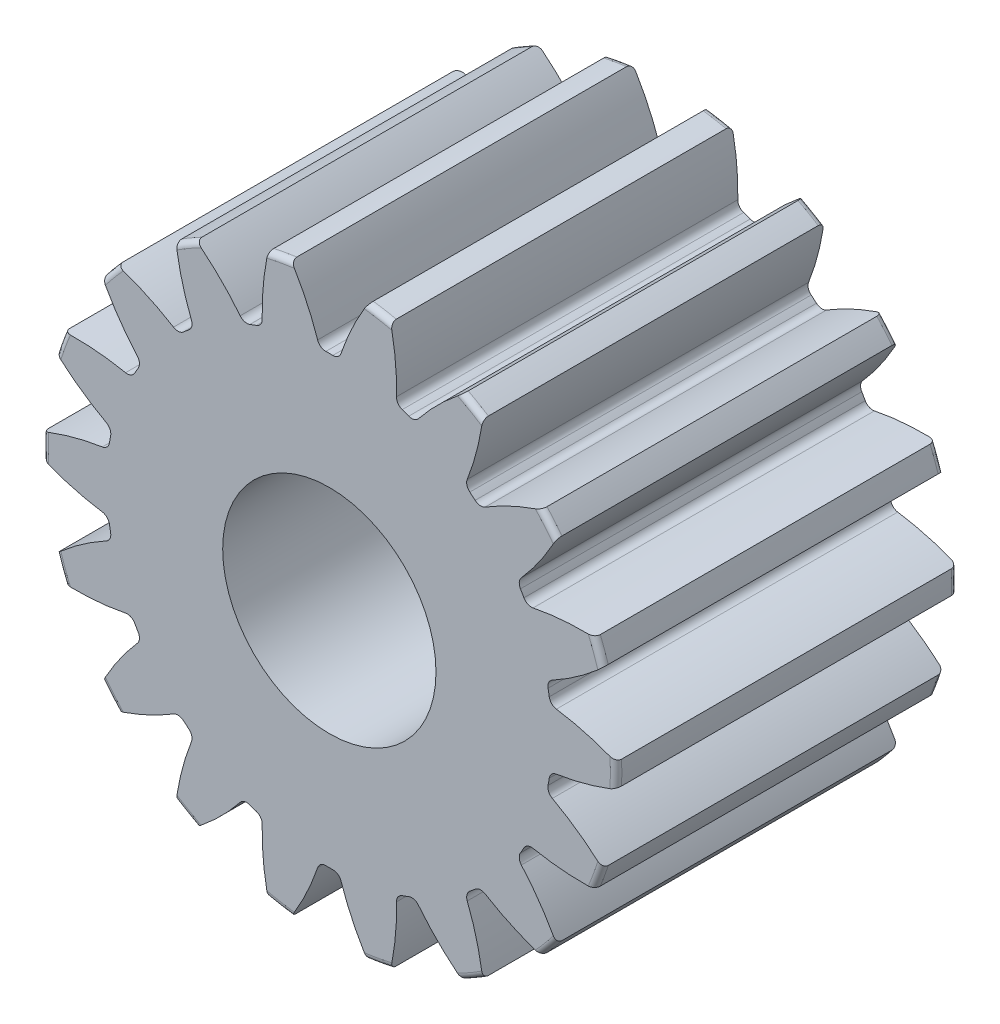
from build123d import *

# Parameters (mm, degrees)
FILLET2_R               = 0.10668
CUT_EXTRUDE2_DEPTH      = 10.860304972
CIRPATTERN1_COUNT       = 18
CUT_EXTRUDE3_DEPTH      = 13.129377689
CUT_EXTRUDE3_DEPTH_BACK = 13.129377689
SKETCH8_W               = 8.16356
SKETCH8_H               = 3.175


with BuildPart() as part:
    # Sketch4 → Revolve1 (revolve)
    with BuildSketch(Plane(origin=(0, 0, 0), x_dir=(0, 0, -1), z_dir=(1, 0, 0))):
        Polygon((-9.525, 1.984375), (-9.525, 3.9751), (-6.35, 3.9751), (-6.35, 5.334), (0, 5.334), (0, 1.984375), align=None)
    revolve(axis=Axis((0, 0, 3.175), (0, 0, 1)))

    # Fillet2
    fillet2_edges = [part.edges().sort_by_distance(p)[0] for p in [
        (0, -5.334, 0),
        (0, -5.334, 6.35),
        (0, -3.9751, 6.35),
        (0, -3.9751, 9.525),
    ]]
    fillet(fillet2_edges, radius=FILLET2_R)

    # Sketch7 → Cut-Extrude2 (cut, through all)
    with BuildSketch(Plane.XY.offset(6.35)):
        with BuildLine():
            ThreePointArc((-0.064763188, 4.142868827), (0, 4.143375), (0.064763188, 4.142868827))
            ThreePointArc((0.064763188, 4.142868827), (0.158874403, 4.171960564), (0.217710969, 4.250963782))
            ThreePointArc((0.217710969, 4.250963782), (0.433564361, 4.783553385), (0.711994388, 5.286267113))
            ThreePointArc((0.711994388, 5.286267113), (0, 5.334), (-0.711994388, 5.286267113))
            ThreePointArc((-0.711994388, 5.286267113), (-0.433564361, 4.783553385), (-0.217710969, 4.250963782))
            ThreePointArc((-0.217710969, 4.250963782), (-0.158874403, 4.171960564), (-0.064763188, 4.142868827))
        make_face()
    cut_extrude2 = extrude(amount=-CUT_EXTRUDE2_DEPTH, mode=Mode.SUBTRACT)

    # CirPattern1: Cut-Extrude2 ×18 about axis
    cirpattern1_axis = Axis((0, 0, 0), (0, 0, 1))
    for i in range(1, CIRPATTERN1_COUNT):
        add(cut_extrude2.rotate(cirpattern1_axis, i * 360 / CIRPATTERN1_COUNT), mode=Mode.SUBTRACT)

    # Sketch8 → Cut-Extrude3 (cut, two sides: drawn at the far end of the back side and taken through both)
    with BuildSketch(Plane(origin=(0, 0, 0), x_dir=(1, 0, 0), z_dir=(0, 1, 0)).offset(-CUT_EXTRUDE3_DEPTH_BACK)):
        with Locations((0, -7.9375)):
            Rectangle(SKETCH8_W, SKETCH8_H)
    extrude(amount=CUT_EXTRUDE3_DEPTH + CUT_EXTRUDE3_DEPTH_BACK, mode=Mode.SUBTRACT)


solid = part.part
